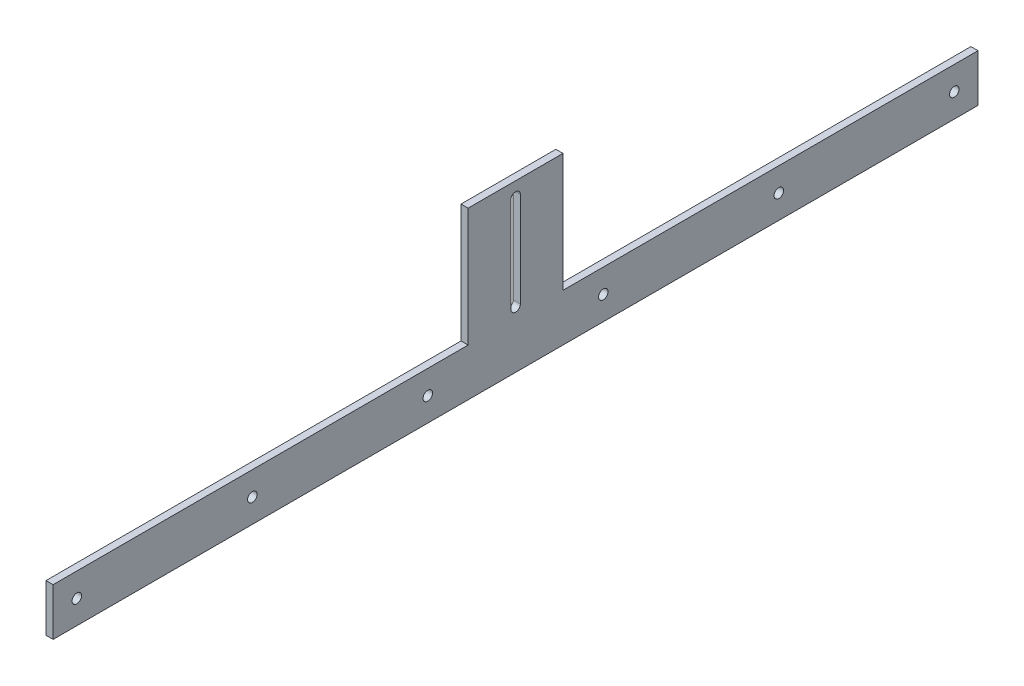
from build123d import *

# Parameters (mm, degrees)
IZIM1_W                     = 390
IZIM1_H                     = 20
IZIM1_R                     = 2
Y_KSEKLIK_EKSTR_ZYON1_DEPTH = 3
IZIM2_W                     = 40
IZIM2_H                     = 50
Y_KSEKLIK_EKSTR_ZYON2_DEPTH = 3


with BuildPart() as part:
    # Çizim1 → Yükseklik-Ekstrüzyon1 (new body)
    with BuildSketch(Plane(origin=(0, 0, 0), x_dir=(0, 0, -1), z_dir=(1, 0, 0))):
        with Locations((195, 10)):
            Rectangle(IZIM1_W, IZIM1_H)
        with Locations((10, 10)):
            Circle(IZIM1_R, mode=Mode.SUBTRACT)
        with Locations((84, 10)):
            Circle(IZIM1_R, mode=Mode.SUBTRACT)
        with Locations((158, 10)):
            Circle(IZIM1_R, mode=Mode.SUBTRACT)
        with Locations((232, 10)):
            Circle(IZIM1_R, mode=Mode.SUBTRACT)
        with Locations((306, 10)):
            Circle(IZIM1_R, mode=Mode.SUBTRACT)
        with Locations((380, 10)):
            Circle(IZIM1_R, mode=Mode.SUBTRACT)
    extrude(amount=Y_KSEKLIK_EKSTR_ZYON1_DEPTH)

    # Çizim2 → Yükseklik-Ekstrüzyon2 (add)
    with BuildSketch(Plane(origin=(3, 0, 0), x_dir=(0, 0, -1), z_dir=(1, 0, 0))):
        with Locations((195, 45)):
            Rectangle(IZIM2_W, IZIM2_H)
        with BuildLine():
            Line((197, 64), (197, 24))
            ThreePointArc((197, 24), (195, 22), (193, 24))
            Line((193, 24), (193, 64))
            ThreePointArc((193, 64), (195, 66), (197, 64))
        make_face(mode=Mode.SUBTRACT)
    extrude(amount=-Y_KSEKLIK_EKSTR_ZYON2_DEPTH)


solid = part.part
